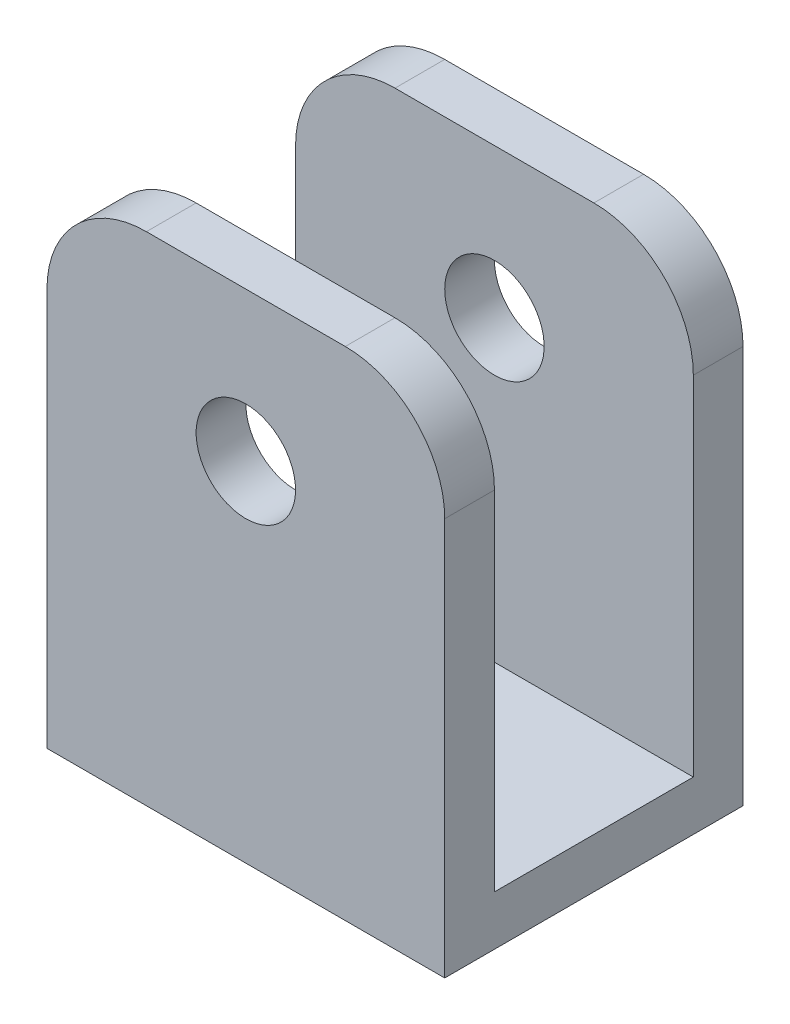
from build123d import *

# Parameters (mm, degrees)
SKETCH1_R           = 5
BOSS_EXTRUDE4_DEPTH = 5
SKETCH4_W           = 40
SKETCH4_H           = 5
BOSS_EXTRUDE5_DEPTH = 20
BOSS_EXTRUDE6_START = 5
SKETCH5_R           = 5
BOSS_EXTRUDE6_DEPTH = 5
SKETCH7_R           = 2
CUT_EXTRUDE1_DEPTH  = 15


with BuildPart() as part:
    # Sketch1 → Boss-Extrude4 (new body)
    with BuildSketch(Plane.XY):
        with BuildLine():
            Line((-20, -35), (20, -35))
            Line((20, -35), (20, 5))
            ThreePointArc((20, 5), (17.071067812, 12.071067812), (10, 15))
            Line((10, 15), (-10, 15))
            ThreePointArc((-10, 15), (-17.071067812, 12.071067812), (-20, 5))
            Line((-20, 5), (-20, -35))
        make_face()
        Circle(SKETCH1_R, mode=Mode.SUBTRACT)
    extrude(amount=BOSS_EXTRUDE4_DEPTH)

    # Sketch4 → Boss-Extrude5 (add)
    with BuildSketch(Plane(origin=(0, 0, 0), x_dir=(-1, 0, 0), z_dir=(0, 0, -1))):
        with Locations((0, -32.5)):
            Rectangle(SKETCH4_W, SKETCH4_H)
    extrude(amount=BOSS_EXTRUDE5_DEPTH)

    # Sketch5 → Boss-Extrude6 (add)
    with BuildSketch(Plane(origin=(0, 0, -20), x_dir=(-1, 0, 0), z_dir=(0, 0, -1)).offset(BOSS_EXTRUDE6_START)):
        with BuildLine():
            Line((-20, 5), (-20, -35))
            Line((-20, -35), (20, -35))
            Line((20, -35), (20, -30))
            Line((20, -30), (20, 5))
            ThreePointArc((20, 5), (17.071067812, 12.071067812), (10, 15))
            Line((10, 15), (-10, 15))
            ThreePointArc((-10, 15), (-17.071067812, 12.071067812), (-20, 5))
        make_face()
        with Locations(Location((0, 0, 0), (0, 0, 180))):
            Circle(SKETCH5_R, mode=Mode.SUBTRACT)
    extrude(amount=-BOSS_EXTRUDE6_DEPTH)

    # Sketch7 → Cut-Extrude1 (cut)
    with BuildSketch(Plane(origin=(0, -30, 0), x_dir=(1, 0, 0), z_dir=(0, 1, 0))):
        with Locations(Location((-7, 10, 0), (0, 0, 270))):
            Circle(SKETCH7_R)
        with Locations(Location((7, 10, 0), (0, 0, 270))):
            Circle(SKETCH7_R)
    extrude(amount=-CUT_EXTRUDE1_DEPTH, mode=Mode.SUBTRACT)


solid = part.part
